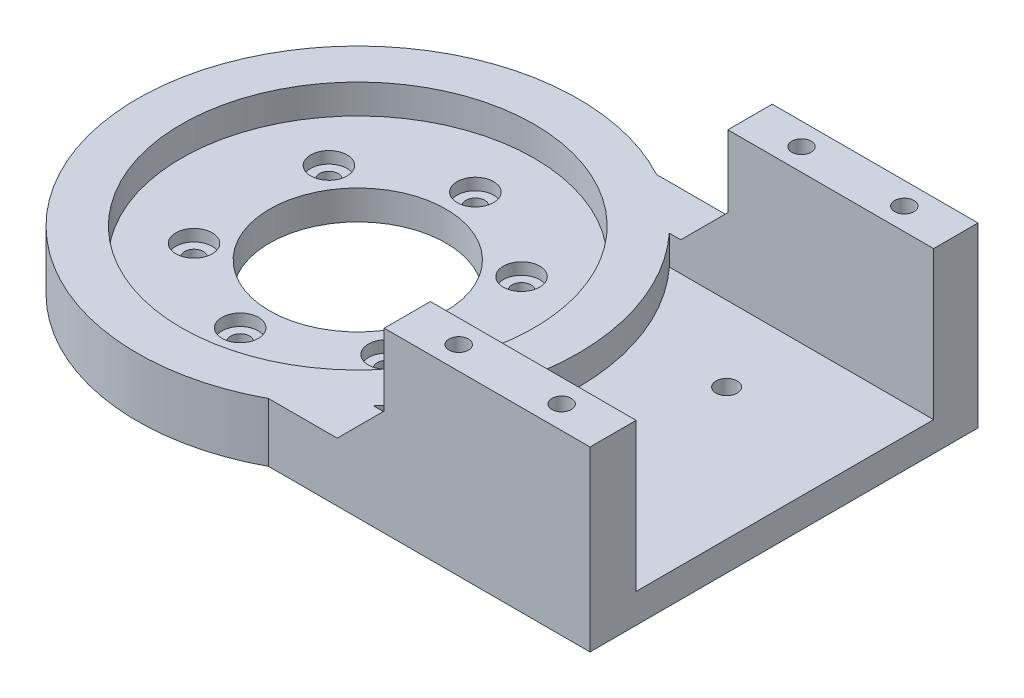
from build123d import *

# Parameters (mm, degrees)
SKETCH1_R                            = 37.5
SKETCH1_R_2                          = 15
BOSS_EXTRUDE2_DEPTH                  = 5
SKETCH3_R                            = 37.5
SKETCH3_R_2                          = 30
BOSS_EXTRUDE3_DEPTH                  = 5
SKETCH4_R                            = 1.6
CUT_EXTRUDE1_DEPTH                   = 5
SKETCH5_R                            = 3.1
CUT_EXTRUDE2_DEPTH                   = 2
BOSS_EXTRUDE4_DEPTH                  = 35
BOSS_EXTRUDE4_DIRECTION_2_REACH      = 86.447
BOSS_EXTRUDE4_DIRECTION_2_END_RADIUS = 37.5
SKETCH9_W                            = 35
SKETCH9_H                            = 7.85
SKETCH9_H_2                          = 7.55
BOSS_EXTRUDE5_DEPTH                  = 20.2
CHAMFER1_SIZE                        = 8
SKETCH11_R                           = 1.65
CUT_EXTRUDE3_DEPTH                   = 88.031833257
SKETCH12_R                           = 3.1
CUT_EXTRUDE4_DEPTH                   = 2.5
SKETCH15_R                           = 1.8
CUT_EXTRUDE5_DEPTH                   = 10


with BuildPart() as part:
    # Sketch1 → Boss-Extrude2 (new body)
    with BuildSketch(Plane(origin=(0, 0, 0), x_dir=(1, 0, 0), z_dir=(0, 1, 0))):
        with Locations(Location((0, 0, 0), (0, 0, 270))):
            Circle(SKETCH1_R)
        with Locations(Location((0, 0, 0), (0, 0, 270))):
            Circle(SKETCH1_R_2, mode=Mode.SUBTRACT)
    extrude(amount=BOSS_EXTRUDE2_DEPTH)

    # Sketch3 → Boss-Extrude3 (add)
    with BuildSketch(Plane(origin=(0, 5, 0), x_dir=(1, 0, 0), z_dir=(0, 1, 0))):
        with Locations(Location((0, 0, 0), (0, 0, 270))):
            Circle(SKETCH3_R)
        with Locations(Location((0, 0, 0), (0, 0, 270))):
            Circle(SKETCH3_R_2, mode=Mode.SUBTRACT)
    extrude(amount=BOSS_EXTRUDE3_DEPTH)

    # Sketch4 → Cut-Extrude1 (cut)
    with BuildSketch(Plane(origin=(0, 5, 0), x_dir=(1, 0, 0), z_dir=(0, 1, 0))):
        with Locations(Location((0, 20, 0), (0, 0, 270))):
            Circle(SKETCH4_R)
        with Locations(Location((-16.383040886, 11.471528727, 0), (0, 0, 270))):
            Circle(SKETCH4_R)
        with Locations(Location((16.383040886, 11.471528727, 0), (0, 0, 270))):
            Circle(SKETCH4_R)
        with Locations(Location((16.383040886, -11.471528727, 0), (0, 0, 90))):
            Circle(SKETCH4_R)
        with Locations(Location((0, -20, 0), (0, 0, 90))):
            Circle(SKETCH4_R)
        with Locations(Location((-16.383040886, -11.471528727, 0), (0, 0, 90))):
            Circle(SKETCH4_R)
    extrude(amount=-CUT_EXTRUDE1_DEPTH, mode=Mode.SUBTRACT)

    # Sketch5 → Cut-Extrude2 (cut)
    with BuildSketch(Plane(origin=(0, 5, 0), x_dir=(1, 0, 0), z_dir=(0, 1, 0))):
        with Locations(Location((0, 20, 0), (0, 0, 270))):
            Circle(SKETCH5_R)
        with Locations(Location((-16.383040886, 11.471528727, 0), (0, 0, 270))):
            Circle(SKETCH5_R)
        with Locations(Location((16.383040886, 11.471528727, 0), (0, 0, 270))):
            Circle(SKETCH5_R)
        with Locations(Location((16.383040886, -11.471528727, 0), (0, 0, 90))):
            Circle(SKETCH5_R)
        with Locations(Location((-16.383040886, -11.471528727, 0), (0, 0, 90))):
            Circle(SKETCH5_R)
        with Locations(Location((0, -20, 0), (0, 0, 90))):
            Circle(SKETCH5_R)
    extrude(amount=-CUT_EXTRUDE2_DEPTH, mode=Mode.SUBTRACT)

    # Sketch8 → Boss-Extrude4 (add)
    with BuildSketch(Plane(origin=(37.5, 0, 0), x_dir=(0, 0, -1), z_dir=(1, 0, 0))):
        Polygon((33, 0), (33, 10), (25.45, 10), (25.45, 5), (-25.15, 5), (-25.15, 10), (-33, 10), (-33, 0), align=None)
    extrude(amount=BOSS_EXTRUDE4_DEPTH)

    # Boss-Extrude4 direction 2: up to this cylinder (the profile starts outside it)
    boss_extrude4_direction_2_end = Plane(origin=(0, 3.445946, 0), z_dir=(0, -1, 0)) * Cylinder(BOSS_EXTRUDE4_DIRECTION_2_END_RADIUS, 248.894, mode=Mode.PRIVATE)
    # Sketch8 → Boss-Extrude4 direction 2 (add, up to the surface)
    with BuildSketch(Plane(origin=(37.5, 0, 0), x_dir=(0, 0, -1), z_dir=(1, 0, 0)), mode=Mode.PRIVATE) as boss_extrude4_direction_2_sk1:
        Polygon((33, 0), (33, 10), (25.45, 10), (25.45, 5), (-25.15, 5), (-25.15, 10), (-33, 10), (-33, 0), align=None)
    boss_extrude4_direction_2_tool1 = extrude(boss_extrude4_direction_2_sk1.sketch, amount=-BOSS_EXTRUDE4_DIRECTION_2_REACH, mode=Mode.PRIVATE) - boss_extrude4_direction_2_end
    add(boss_extrude4_direction_2_tool1.solids().sort_by_distance((37.5, 3.445946, 0.093243))[0])
    add(boss_extrude4_direction_2_tool1.solids().sort_by_distance((37.5, 3.445946, 0.093243))[1])

    # Sketch9 → Boss-Extrude5 (add)
    with BuildSketch(Plane(origin=(0, 10, 0), x_dir=(1, 0, 0), z_dir=(0, 1, 0))):
        with Locations((55, -29.075)):
            Rectangle(SKETCH9_W, SKETCH9_H)
        with Locations((55, 29.225)):
            Rectangle(SKETCH9_W, SKETCH9_H_2)
    extrude(amount=BOSS_EXTRUDE5_DEPTH)

    # Chamfer1
    chamfer1_edges = [part.edges().sort_by_distance(p)[0] for p in [
        (37.5, 10, 29.075),
        (37.5, 10, -29.225),
    ]]
    chamfer(chamfer1_edges, length=CHAMFER1_SIZE)

    # Sketch11 → Cut-Extrude3 (cut, through all)
    with BuildSketch(Plane(origin=(0, 30.2, 0), x_dir=(1, 0, 0), z_dir=(0, 1, 0))):
        with Locations(Location((46.25, 29.225, 0), (0, 0, 270))):
            Circle(SKETCH11_R)
        with Locations(Location((63.75, 29.225, 0), (0, 0, 270))):
            Circle(SKETCH11_R)
        with Locations(Location((63.75, -29.075, 0), (0, 0, 270))):
            Circle(SKETCH11_R)
        with Locations(Location((46.25, -29.075, 0), (0, 0, 270))):
            Circle(SKETCH11_R)
    extrude(amount=-CUT_EXTRUDE3_DEPTH, mode=Mode.SUBTRACT)

    # Sketch12 → Cut-Extrude4 (cut)
    with BuildSketch(Plane.XZ):
        with Locations(Location((46.25, 29.075, 0), (0, 0, 270))):
            Circle(SKETCH12_R)
        with Locations(Location((63.75, 29.075, 0), (0, 0, 270))):
            Circle(SKETCH12_R)
        with Locations(Location((63.75, -29.225, 0), (0, 0, 270))):
            Circle(SKETCH12_R)
        with Locations(Location((46.25, -29.225, 0), (0, 0, 270))):
            Circle(SKETCH12_R)
    extrude(amount=-CUT_EXTRUDE4_DEPTH, mode=Mode.SUBTRACT)

    # Sketch15 → Cut-Extrude5 (cut)
    with BuildSketch(Plane(origin=(0, 5, 0), x_dir=(1, 0, 0), z_dir=(0, 1, 0))):
        with Locations(Location((50.089797686, 12.65, 0), (0, 0, 270))):
            Circle(SKETCH15_R)
        with Locations(Location((50.089797686, -12.65, 0), (0, 0, 270))):
            Circle(SKETCH15_R)
    extrude(amount=-CUT_EXTRUDE5_DEPTH, mode=Mode.SUBTRACT)


solid = part.part
